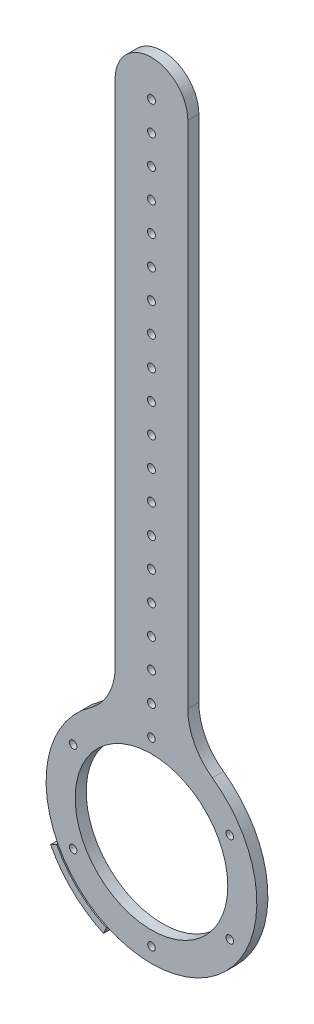
from build123d import *

# Parameters (mm, degrees)
BOSS_EXTRUDE1_DEPTH                             = 4.826
SKETCH2_R                                       = 33.3375
CUT_EXTRUDE1_DEPTH                              = 347.01033464659696
FILLET1_R                                       = 25.400000000000002
LPATTERN2_COUNT                                 = 19
LPATTERN2_PITCH                                 = 12.7
CSK_FOR_M3_FLAT_HEAD_MACHINE_SCREW1_D           = 3.3
CSK_FOR_M3_FLAT_HEAD_MACHINE_SCREW1_CSINK_D     = 6.35
CSK_FOR_M3_FLAT_HEAD_MACHINE_SCREW1_CSINK_ANGLE = 90
CIRPATTERN1_COUNT                               = 6
BOSS_EXTRUDE2_DEPTH                             = 7
BOSS_EXTRUDE2_DEPTH_BACK                        = 5.326


with BuildPart() as part:
    # Sketch1 → Boss-Extrude1 (new body)
    with BuildSketch(Plane.XY):
        with BuildLine():
            Line((15.875, 89.25133784449143), (15.875, 327.02500000000003))
            ThreePointArc((15.875, 327.02500000000003), (3.68e-15, 342.90000000000003), (-15.875, 327.02500000000003))
            Line((-15.875, 327.02500000000003), (-15.875, 89.25133784449143))
            ThreePointArc((-15.875, 89.25133784449143), (-8.46e-15, 7.11e-15), (15.875, 89.25133784449143))
        make_face()
    extrude(amount=BOSS_EXTRUDE1_DEPTH)

    # Sketch2 → Cut-Extrude1 (cut, through all)
    with BuildSketch(Plane.XY.offset(4.826)):
        with Locations((0, 46.0375)):
            Circle(SKETCH2_R)
    extrude(amount=-CUT_EXTRUDE1_DEPTH, mode=Mode.SUBTRACT)

    # Fillet1
    fillet1_edges = [part.edges().sort_by_distance(p)[0] for p in [
        (15.875000000000002, 89.25133784449145, 2.413),
        (-15.874999999999998, 89.25133784449142, 2.413),
    ]]
    fillet(fillet1_edges, radius=FILLET1_R)

    # Sketch4 → #8-32 Tapped Hole1 (revolve, cut)
    with BuildSketch(Plane(origin=(2.71e-15, 327.02500000000003, 4.826), x_dir=(0, -1, 0), z_dir=(1, 0, 0))):
        Polygon((0, 0), (-2.87e-15, 11.705806461184395), (1.7271999999999874, 10.667999999999997), (1.7271999999999894, -1.34e-15), align=None)
    f_8_32_tapped_hole1 = revolve(axis=Axis((2.71e-15, 327.02500000000003, 11.175999999999991), (0, 0, -1)), mode=Mode.SUBTRACT)

    # LPattern2: #8-32 Tapped Hole1 ×19
    with Locations(*[(0, -i * LPATTERN2_PITCH, 0) for i in range(1, LPATTERN2_COUNT)]):
        add(f_8_32_tapped_hole1, mode=Mode.SUBTRACT)

    # CSK for M3 Flat Head Machine Screw1 (through all)
    with Locations(Plane(origin=(0, 0, 0), x_dir=(-1, 0, 0), z_dir=(0, 0, -1))):
        with Locations((0, 85.537499994)):
            csk_for_m3_flat_head_machine_screw1 = CounterSinkHole(CSK_FOR_M3_FLAT_HEAD_MACHINE_SCREW1_D / 2, CSK_FOR_M3_FLAT_HEAD_MACHINE_SCREW1_CSINK_D / 2, counter_sink_angle=CSK_FOR_M3_FLAT_HEAD_MACHINE_SCREW1_CSINK_ANGLE)

    # CirPattern1: CSK for M3 Flat Head Machine Screw1 ×6 about axis
    cirpattern1_axis = Axis((0, 46.0375, 4.826), (0, 0, -1))
    for i in range(1, CIRPATTERN1_COUNT):
        add(csk_for_m3_flat_head_machine_screw1.rotate(cirpattern1_axis, i * 360 / CIRPATTERN1_COUNT), mode=Mode.SUBTRACT)

    # Sketch10 → Boss-Extrude2 (add, two sides: drawn at the far end of the back side and taken through both)
    with BuildSketch(Plane(origin=(0, 0, 0), x_dir=(-1, 0, 0), z_dir=(0, 0, -1)).offset(-BOSS_EXTRUDE2_DEPTH_BACK)):
        with BuildLine():
            Line((43.56363224338846, 23.52336328519776), (40.89851071944933, 24.900725714856833))
            ThreePointArc((40.89851071944933, 24.90072571485683), (31.779922400083834, 12.728523154491043), (19.192959693323502, 4.19157182938271))
            Line((19.192959693323495, 4.19157182938271), (20.443654867474322, 1.4647125405018753))
            ThreePointArc((20.443654867474315, 1.4647125405018642), (33.850837788631225, 10.557968051878447), (43.56363224338847, 23.52336328519776))
        make_face()
    extrude(amount=BOSS_EXTRUDE2_DEPTH + BOSS_EXTRUDE2_DEPTH_BACK)

    # Sweep2: sweep along a curve in space
    with BuildLine() as sweep2_path:
        ThreePointArc((-40.89851071944929, 24.900725714856783, 1.73e-15), (-31.779922400083795, 12.728523154491036, 9.2e-16), (-19.192959693323488, 4.191571829382735, 0))
    # Sketch12 → Sweep2 (sweep)
    with BuildSketch(Plane(origin=(-17.445500140285052, 8.001514022037082, 0), x_dir=(0, 0, -1), z_dir=(0.908953096293619, -0.41689839138361184, 0))):
        with BuildLine():
            Line((0, -4.191571829382516), (3.5, -4.191571829382516))
            ThreePointArc((3.5, -4.191571829382516), (1.4844355629253627, -3.6563095942631314), (0, -2.1915718293825166))
            Line((0, -2.1915718293825166), (0, -4.191571829382516))
        make_face()
    sweep(path=sweep2_path.line)


solid = part.part
